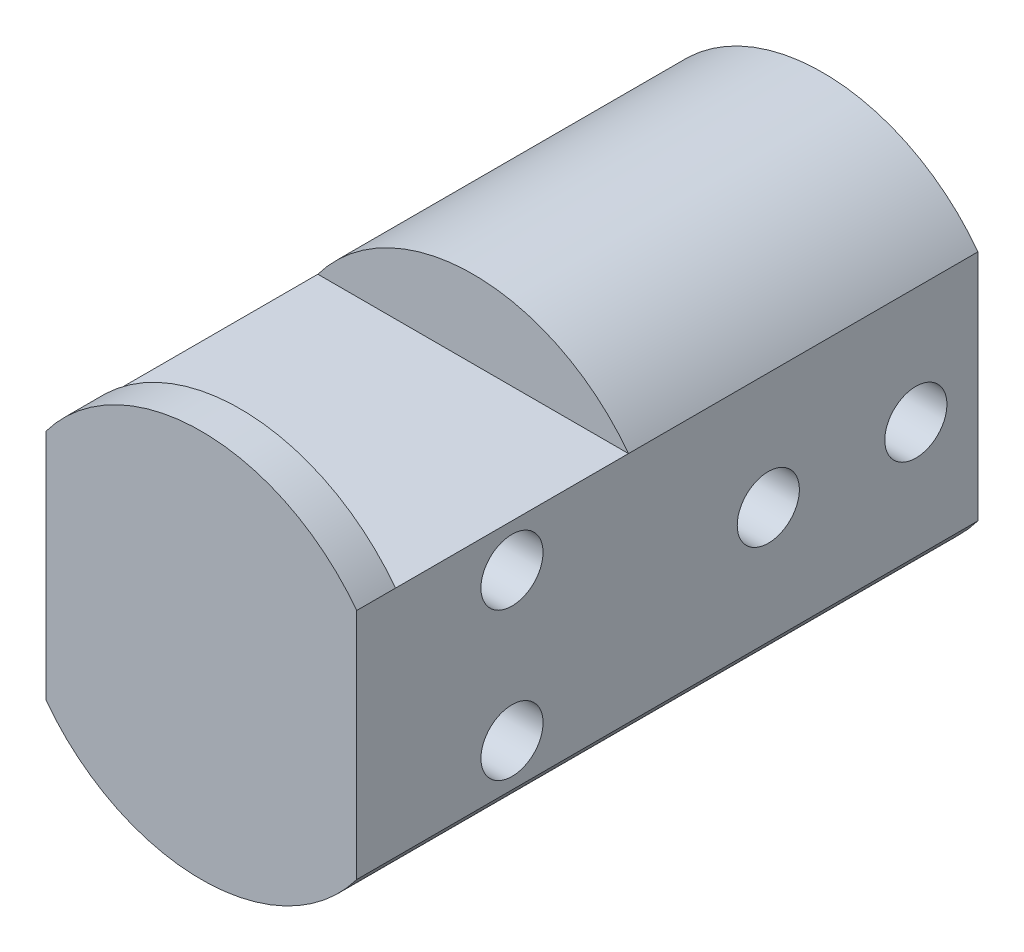
from build123d import *

# Parameters (mm, degrees)
EXTRUDE_1_DEPTH     = 80
SKETCH_2_W          = 15
SKETCH_2_H          = 15
CUT_EXTRUDE_1_DEPTH = 35
SKETCH_3_R          = 4
CUT_EXTRUDE_2_DEPTH = 93.870878105
CUT_EXTRUDE_START   = -35
CUT_EXTRUDE_4_DEPTH = 35
FILLET_1_R          = 1
EXTRUDE_START       = -5
EXTRUDE_2_DEPTH     = 5


with BuildPart() as part:
    # 草图1 → 凸台-拉伸1 (new body)
    with BuildSketch(Plane.XY):
        with BuildLine():
            Line((-20, 15), (-20, -15))
            ThreePointArc((-20, -15), (0, -25), (20, -15))
            Line((20, -15), (20, 15))
            ThreePointArc((20, 15), (0, 25), (-20, 15))
        make_face()
    extrude(amount=EXTRUDE_1_DEPTH)

    # 草图2 → 切除-拉伸1 (cut)
    with BuildSketch(Plane(origin=(0, 0, 0), x_dir=(-1, 0, 0), z_dir=(0, 0, -1))):
        Rectangle(SKETCH_2_W, SKETCH_2_H)
    extrude(amount=-CUT_EXTRUDE_1_DEPTH, mode=Mode.SUBTRACT)

    # 草图3 → 切除-拉伸2 (cut, through all)
    with BuildSketch(Plane.ZY.offset(20)):
        with Locations((8, 0)):
            Circle(SKETCH_3_R)
        with Locations((27, 0)):
            Circle(SKETCH_3_R)
        with Locations((60, 9.5)):
            Circle(SKETCH_3_R)
        with Locations((60, -9.5)):
            Circle(SKETCH_3_R)
    extrude(amount=-CUT_EXTRUDE_2_DEPTH, mode=Mode.SUBTRACT)

    # 草图6 → 切除-拉伸4 (cut)
    with BuildSketch(Plane.XY.offset(80).offset(CUT_EXTRUDE_START)):
        with BuildLine():
            Line((-20, 15), (20, 15))
            ThreePointArc((20, 15), (0, 25), (-20, 15))
        make_face()
    extrude(amount=CUT_EXTRUDE_4_DEPTH, mode=Mode.SUBTRACT)

    # 圆角1
    fillet_1_edges = [part.edges().sort_by_distance(p)[0] for p in [
        (-7.5, -7.5, 17.5),
        (7.5, -7.5, 17.5),
        (-7.5, 7.5, 17.5),
        (7.5, 7.5, 17.5),
    ]]
    fillet(fillet_1_edges, radius=FILLET_1_R)

    # 草图6<2> → 凸台-拉伸2 (add)
    with BuildSketch(Plane.XY.offset(80).offset(EXTRUDE_START)):
        with BuildLine():
            Line((-20, 15), (20, 15))
            ThreePointArc((20, 15), (0, 25), (-20, 15))
        make_face()
    extrude(amount=EXTRUDE_2_DEPTH)


solid = part.part
